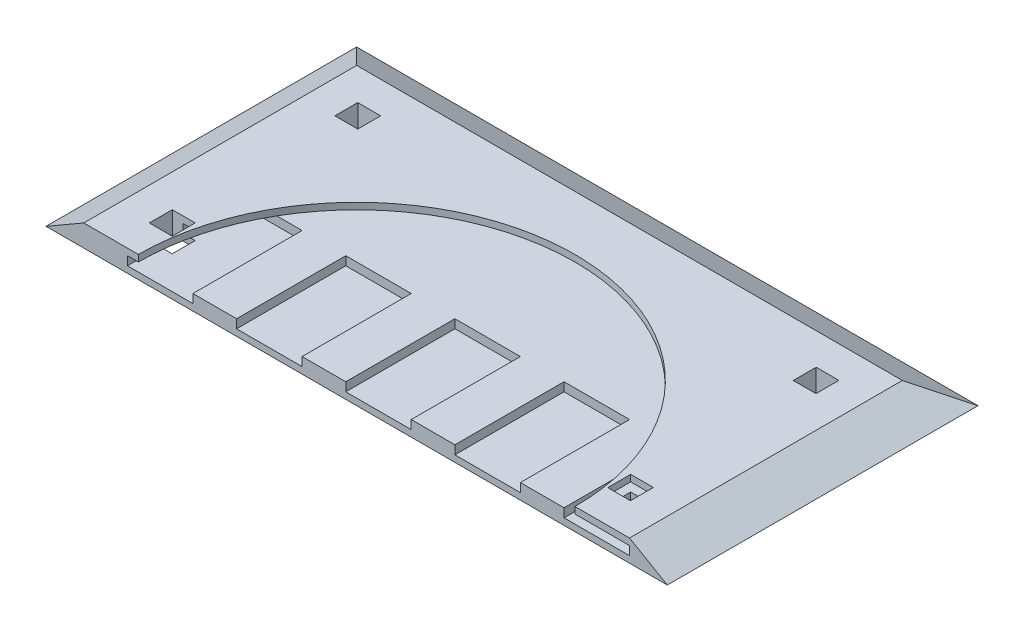
from build123d import *

# Parameters (mm, degrees)
SKETCH_1_W          = 250
SKETCH_1_H          = 125
EXTRUDE_1_DEPTH     = 10
SKETCH_5_W          = 10
SKETCH_5_H          = 10
CUT_EXTRUDE_1_DEPTH = 10
CUT_EXTRUDE_2_DEPTH = 3
SKETCH_7_W          = 30
SKETCH_7_H          = 4
CUT_EXTRUDE_3_DEPTH = 50
EXTRUDE_3_DEPTH     = 250
EXTRUDE_4_REACH     = 191.684
SKETCH_11_W         = 10.5
SKETCH_11_H         = 10.5
SKETCH_11_H_2       = 10.520913438
SKETCH_11_W_2       = 10.415866522
CUT_EXTRUDE_4_DEPTH = 202.519860157


with BuildPart() as part:
    # 草图1 → 凸台-拉伸1 (new body)
    with BuildSketch(Plane(origin=(0, 0, 0), x_dir=(1, 0, 0), z_dir=(0, 1, 0))):
        with Locations((0, 62.5)):
            Rectangle(SKETCH_1_W, SKETCH_1_H)
    extrude(amount=EXTRUDE_1_DEPTH)

    # 草图5 → 切除-拉伸1 (cut)
    with BuildSketch(Plane(origin=(0, 10, 0), x_dir=(1, 0, 0), z_dir=(0, 1, 0))):
        with Locations((-105, 105)):
            Rectangle(SKETCH_5_W, SKETCH_5_H)
        with Locations((-105, 20)):
            Rectangle(SKETCH_5_W, SKETCH_5_H)
        with Locations((105, 105)):
            Rectangle(SKETCH_5_W, SKETCH_5_H)
        with Locations((105, 20)):
            Rectangle(SKETCH_5_W, SKETCH_5_H)
    extrude(amount=-CUT_EXTRUDE_1_DEPTH, mode=Mode.SUBTRACT)

    # 草图6 → 切除-拉伸2 (cut)
    with BuildSketch(Plane(origin=(0, 10, 0), x_dir=(1, 0, 0), z_dir=(0, 1, 0))):
        with BuildLine():
            Line((-100, 0), (100, 0))
            ThreePointArc((100, 0), (0, 100), (-100, 0))
        make_face()
    extrude(amount=-CUT_EXTRUDE_2_DEPTH, mode=Mode.SUBTRACT)

    # 草图7 → 切除-拉伸3 (cut)
    with BuildSketch(Plane.XY):
        with Locations((-90, 5)):
            Rectangle(SKETCH_7_W, SKETCH_7_H)
        with Locations((-40, 5)):
            Rectangle(SKETCH_7_W, SKETCH_7_H)
        with Locations((10, 5)):
            Rectangle(SKETCH_7_W, SKETCH_7_H)
        with Locations((60, 5)):
            Rectangle(SKETCH_7_W, SKETCH_7_H)
        with Locations((110, 5)):
            Rectangle(SKETCH_7_W, SKETCH_7_H)
    extrude(amount=-CUT_EXTRUDE_3_DEPTH, mode=Mode.SUBTRACT)

    # 草图8 → 凸台-拉伸3 (add)
    with BuildSketch(Plane.ZY.offset(125)):
        Polygon((-125, 10), (-125, 0), (-142.320508076, 0), align=None)
    extrude(amount=-EXTRUDE_3_DEPTH)

    # 凸台-拉伸4: up to this plane
    extrude_4_end = Plane(origin=(145, 0, -142.320508076), z_dir=(0, 0.8660254037844419, -0.4999999999999944))
    # 草图9 → 凸台-拉伸4 (add, up to the surface)
    with BuildSketch(Plane.XY, mode=Mode.PRIVATE) as extrude_4_sk1:
        Polygon((-125, 10), (-125, 0), (-142.320508076, 0), align=None)
    extrude_4_tool1 = split(extrude(extrude_4_sk1.sketch, amount=-EXTRUDE_4_REACH, mode=Mode.PRIVATE), bisect_by=extrude_4_end, keep=Keep.BOTH, mode=Mode.PRIVATE)
    add(extrude_4_tool1.solids().sort_by_distance((-130.773503, 3.333333, 0))[0])
    # 草图9 → 凸台-拉伸4 (add, up to the surface)
    with BuildSketch(Plane.XY, mode=Mode.PRIVATE) as extrude_4_sk2:
        Polygon((125, 10), (125, 0), (142.320508076, 0), align=None)
    extrude_4_tool2 = split(extrude(extrude_4_sk2.sketch, amount=-EXTRUDE_4_REACH, mode=Mode.PRIVATE), bisect_by=extrude_4_end, keep=Keep.BOTH, mode=Mode.PRIVATE)
    add(extrude_4_tool2.solids().sort_by_distance((130.773503, 3.333333, 0))[0])

    # 草图11 → 切除-拉伸4 (cut, through all)
    with BuildSketch(Plane(origin=(0, 10, 0), x_dir=(1, 0, 0), z_dir=(0, 1, 0))):
        with Locations((-104.75, 105.25)):
            Rectangle(SKETCH_11_W, SKETCH_11_H)
        with Locations((-104.75, 20.260456719)):
            Rectangle(SKETCH_11_W, SKETCH_11_H_2)
        with Locations((105.207933261, 20.260456719)):
            Rectangle(SKETCH_11_W_2, SKETCH_11_H_2)
        with Locations((105.207933261, 105.25)):
            Rectangle(SKETCH_11_W_2, SKETCH_11_H)
    extrude(amount=-CUT_EXTRUDE_4_DEPTH, mode=Mode.SUBTRACT)


solid = part.part
